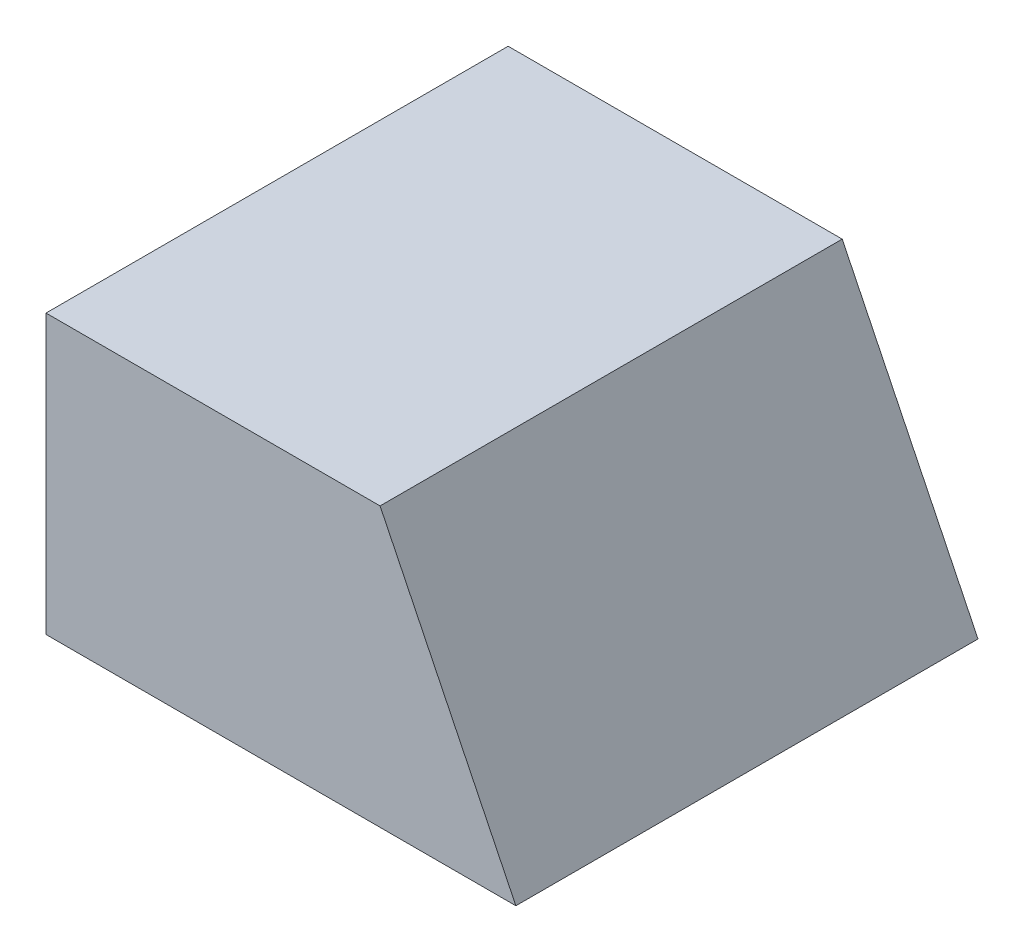
from build123d import *

# Parameters (mm, degrees)
EXTRUDE_2_DEPTH = 4150


with BuildPart() as part:
    # Эскиз1 → Бобышка-Вытянуть2 (new body)
    with BuildSketch(Plane.XY):
        Polygon((0, 0), (4219.457002785, 0), (3000, 2500), (0, 2500), align=None)
    extrude(amount=-EXTRUDE_2_DEPTH)


solid = part.part
